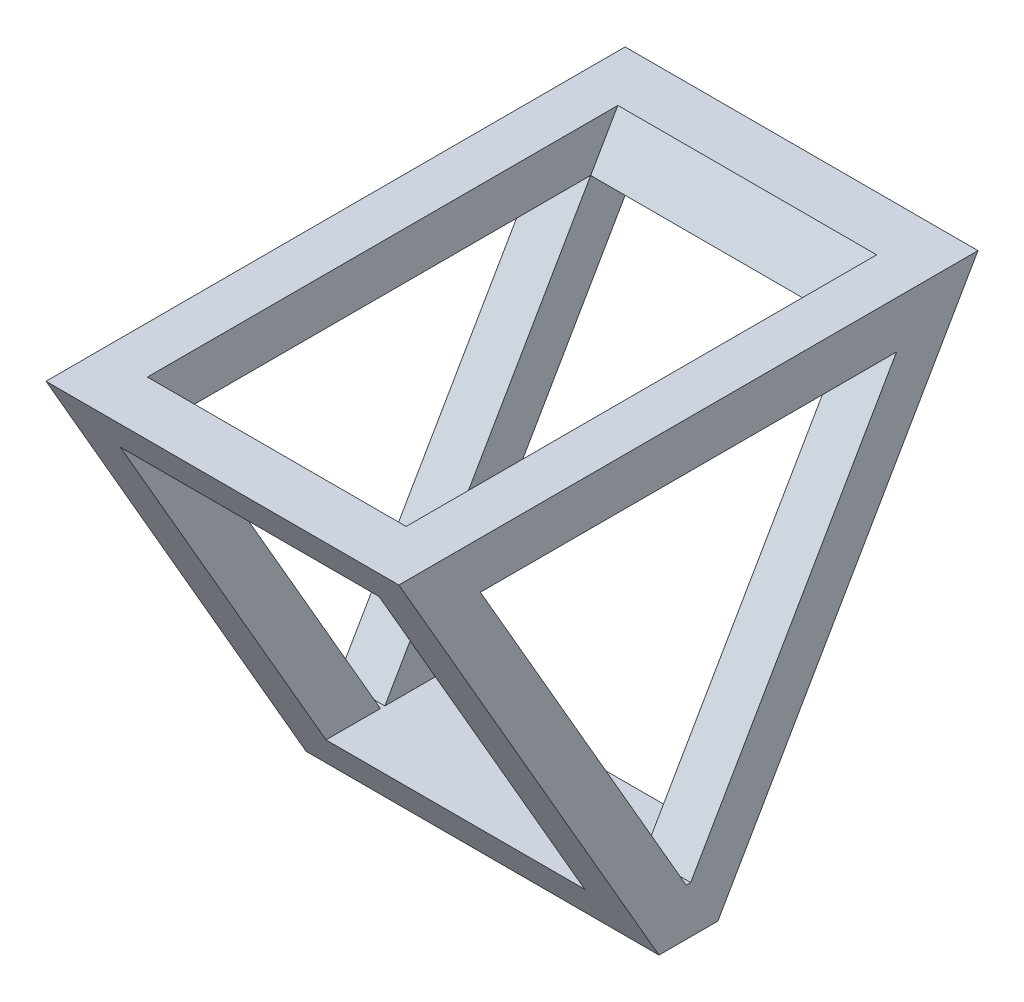
from build123d import *

# Parameters (mm, degrees)
BOSS_EXTRUDE2_DEPTH             = 30
CUT_EXTRUDE1_DEPTH              = 55.53264752
CUT_EXTRUDE1_DEPTH_BACK         = 55.53264752
SKETCH3_W                       = 22
SKETCH3_H                       = 30.310889132
BOSS_EXTRUDE3_REACH             = 56.533
SKETCH4_W                       = 4
SKETCH4_H                       = 4
BOSS_EXTRUDE3_DIRECTION_2_REACH = 56.533


with BuildPart() as part:
    # Sketch2 → Boss-Extrude2 (new body)
    with BuildSketch(Plane(origin=(0, 0, 0), x_dir=(0, 0, -1), z_dir=(1, 0, 0))):
        Polygon((-2.5, 0), (2.5, 0), (24.618802154, 38.310889132), (20, 38.310889132), (0.190598923, 4), (-0.190598923, 4), (-20, 38.310889132), (-24.618802154, 38.310889132), align=None)
    extrude(amount=BOSS_EXTRUDE2_DEPTH)

    # Sketch3 → Cut-Extrude1 (cut, two sides: drawn at the far end of the back side and taken through both)
    with BuildSketch(Plane.XY.offset(-CUT_EXTRUDE1_DEPTH_BACK)):
        with Locations((15, 19.155444566)):
            Rectangle(SKETCH3_W, SKETCH3_H)
    extrude(amount=CUT_EXTRUDE1_DEPTH + CUT_EXTRUDE1_DEPTH_BACK, mode=Mode.SUBTRACT)

    # Boss-Extrude3: up to this plane
    boss_extrude3_end = Plane(origin=(30, 4, 0.190598923), z_dir=(0, -0.49999999999999795, 0.8660254037844398))
    # Sketch4 → Boss-Extrude3 (add, up to the surface)
    with BuildSketch(Plane.XY, mode=Mode.PRIVATE) as boss_extrude3_sk1:
        with Locations((2, 36.310889132)):
            Rectangle(SKETCH4_W, SKETCH4_H)
    boss_extrude3_tool1 = split(extrude(boss_extrude3_sk1.sketch, amount=BOSS_EXTRUDE3_REACH, mode=Mode.PRIVATE), bisect_by=boss_extrude3_end, keep=Keep.BOTH, mode=Mode.PRIVATE)
    add(boss_extrude3_tool1.solids().sort_by_distance((2, 36.310889, 0))[0])
    # Sketch4 → Boss-Extrude3 (add, up to the surface)
    with BuildSketch(Plane.XY, mode=Mode.PRIVATE) as boss_extrude3_sk2:
        with Locations((28, 36.310889132)):
            Rectangle(SKETCH4_W, SKETCH4_H)
    boss_extrude3_tool2 = split(extrude(boss_extrude3_sk2.sketch, amount=BOSS_EXTRUDE3_REACH, mode=Mode.PRIVATE), bisect_by=boss_extrude3_end, keep=Keep.BOTH, mode=Mode.PRIVATE)
    add(boss_extrude3_tool2.solids().sort_by_distance((28, 36.310889, 0))[0])

    # Boss-Extrude3 direction 2: up to this plane
    boss_extrude3_direction_2_end = Plane(origin=(30, 38.310889132, -20), z_dir=(0, -0.49999999999999756, -0.8660254037844402))
    # Sketch4 → Boss-Extrude3 direction 2 (add, up to the surface)
    with BuildSketch(Plane.XY, mode=Mode.PRIVATE) as boss_extrude3_direction_2_sk1:
        with Locations((2, 36.310889132)):
            Rectangle(SKETCH4_W, SKETCH4_H)
    boss_extrude3_direction_2_tool1 = split(extrude(boss_extrude3_direction_2_sk1.sketch, amount=-BOSS_EXTRUDE3_DIRECTION_2_REACH, mode=Mode.PRIVATE), bisect_by=boss_extrude3_direction_2_end, keep=Keep.BOTH, mode=Mode.PRIVATE)
    add(boss_extrude3_direction_2_tool1.solids().sort_by_distance((2, 36.310889, 0))[0])
    # Sketch4 → Boss-Extrude3 direction 2 (add, up to the surface)
    with BuildSketch(Plane.XY, mode=Mode.PRIVATE) as boss_extrude3_direction_2_sk2:
        with Locations((28, 36.310889132)):
            Rectangle(SKETCH4_W, SKETCH4_H)
    boss_extrude3_direction_2_tool2 = split(extrude(boss_extrude3_direction_2_sk2.sketch, amount=-BOSS_EXTRUDE3_DIRECTION_2_REACH, mode=Mode.PRIVATE), bisect_by=boss_extrude3_direction_2_end, keep=Keep.BOTH, mode=Mode.PRIVATE)
    add(boss_extrude3_direction_2_tool2.solids().sort_by_distance((28, 36.310889, 0))[0])


solid = part.part
